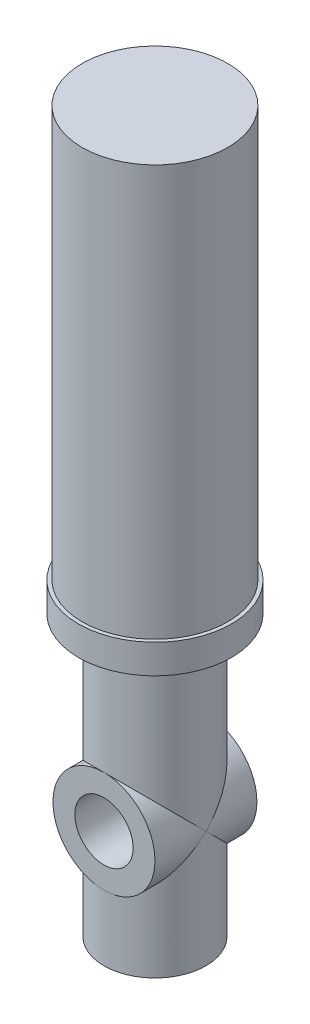
from build123d import *

# Parameters (mm, degrees)
BOSS_EXTRUDE1_DEPTH      = 132
BOSS_EXTRUDE1_DEPTH_BACK = 80
SKETCH1_R                = 35
BOSS_EXTRUDE2_DEPTH      = 35
BOSS_EXTRUDE2_DEPTH_BACK = 35
SKETCH2_R                = 35
SKETCH3_R                = 52.5
BOSS_EXTRUDE3_DEPTH      = 20
SKETCH4_R                = 50
BOSS_EXTRUDE4_DEPTH      = 282
CUT_EXTRUDE1_DEPTH       = 427.390079622
CUT_EXTRUDE1_DEPTH_BACK  = 427.390079622
SKETCH5_R                = 20


with BuildPart() as part:
    # Sketch1 → Boss-Extrude1 (new, two sides: drawn at the far end of the back side and taken through both)
    with BuildSketch(Plane(origin=(0, 0, 0), x_dir=(1, 0, 0), z_dir=(0, 1, 0)).offset(-BOSS_EXTRUDE1_DEPTH_BACK)):
        Circle(SKETCH1_R)
    extrude(amount=BOSS_EXTRUDE1_DEPTH + BOSS_EXTRUDE1_DEPTH_BACK)

    # Sketch2 → Boss-Extrude2 (add, two sides: drawn at the far end of the back side and taken through both)
    with BuildSketch(Plane.XY.offset(-BOSS_EXTRUDE2_DEPTH_BACK)):
        Circle(SKETCH2_R)
    extrude(amount=BOSS_EXTRUDE2_DEPTH + BOSS_EXTRUDE2_DEPTH_BACK)

    # Sketch3 → Boss-Extrude3 (add)
    with BuildSketch(Plane(origin=(0, 132, 0), x_dir=(1, 0, 0), z_dir=(0, 1, 0))):
        Circle(SKETCH3_R)
    extrude(amount=-BOSS_EXTRUDE3_DEPTH)

    # Sketch4 → Boss-Extrude4 (add)
    with BuildSketch(Plane(origin=(0, 132, 0), x_dir=(1, 0, 0), z_dir=(0, 1, 0))):
        Circle(SKETCH4_R)
    extrude(amount=BOSS_EXTRUDE4_DEPTH)

    # Sketch5 → Cut-Extrude1 (cut, two sides: drawn at the far end of the back side and taken through both)
    with BuildSketch(Plane.XY.offset(35).offset(-CUT_EXTRUDE1_DEPTH_BACK)):
        Circle(SKETCH5_R)
    extrude(amount=CUT_EXTRUDE1_DEPTH + CUT_EXTRUDE1_DEPTH_BACK, mode=Mode.SUBTRACT)


solid = part.part
